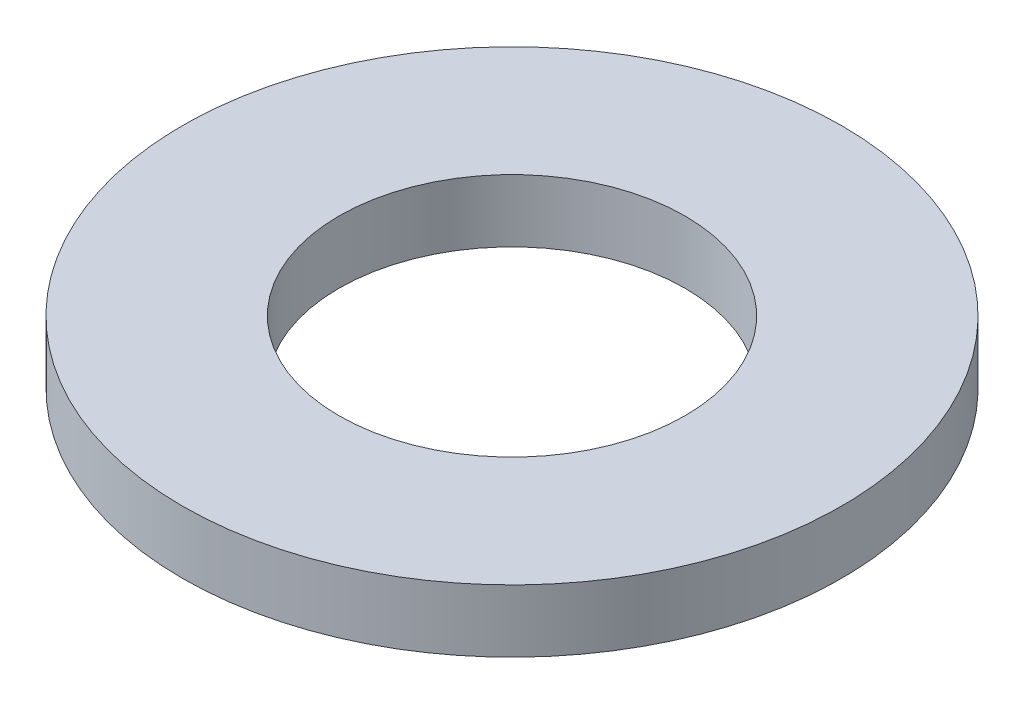
from build123d import *

# Parameters (mm, degrees)
SKETCH2_R           = 10
SKETCH2_R_2         = 5.25
BOSS_EXTRUDE1_DEPTH = 0.95


with BuildPart() as part:
    # Sketch2 → Boss-Extrude1 (new, symmetric)
    with BuildSketch(Plane(origin=(0, 0, 0), x_dir=(1, 0, 0), z_dir=(0, 1, 0))):
        with Locations(Location((0, 0, 0), (0, 0, 90))):
            Circle(SKETCH2_R)
        with Locations(Location((0, 0, 0), (0, 0, 90))):
            Circle(SKETCH2_R_2, mode=Mode.SUBTRACT)
    extrude(amount=BOSS_EXTRUDE1_DEPTH, both=True)


solid = part.part
